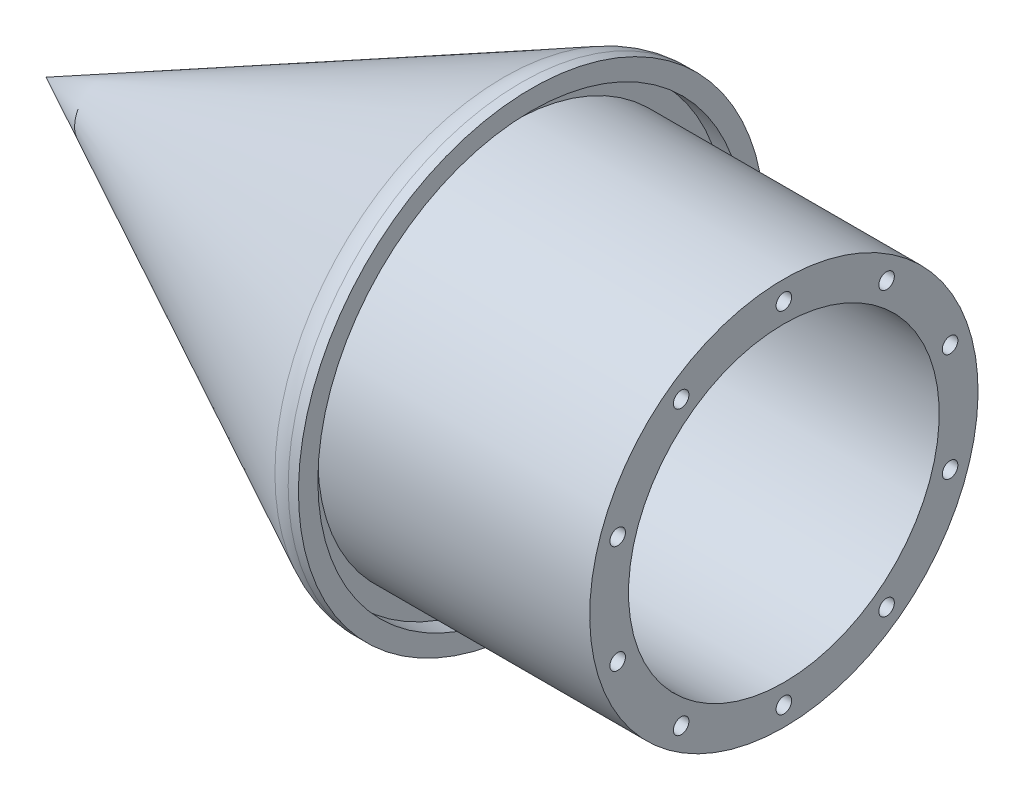
from build123d import *

# Parameters (mm, degrees)
SKETCH2_R          = 2
CUT_EXTRUDE1_DEPTH = 20
FILLET1_R          = 10


with BuildPart() as part:
    # Sketch1 → Revolve1 (revolve)
    with BuildSketch(Plane.XY, mode=Mode.PRIVATE) as revolve1_sk:
        Polygon((-170, 0), (-190, 0), (-70, 60), (-65, 60), (-65, 55), (-70, 55), (-70, 50), (0, 50), (0, 40), (-80, 40), (-80, 45), align=None)
    revolve(revolve1_sk.sketch.rotate(Axis((-170, 0, 0), (1, 0, 0)), 180), axis=Axis((-170, 0, 0), (1, 0, 0)))

    # Sketch2 → Cut-Extrude1 (cut)
    with BuildSketch(Plane(origin=(0, 0, 0), x_dir=(0, 0, -1), z_dir=(1, 0, 0))):
        with Locations(Location((0, 45, 0), (0, 0, 90))):
            Circle(SKETCH2_R)
        with Locations(Location((26.450336353, 36.405764747, 0), (0, 0, 90))):
            Circle(SKETCH2_R)
        with Locations(Location((42.797543233, 13.905764747, 0), (0, 0, 90))):
            Circle(SKETCH2_R)
        with Locations(Location((42.797543233, -13.905764747, 0), (0, 0, 90))):
            Circle(SKETCH2_R)
        with Locations(Location((26.450336353, -36.405764747, 0), (0, 0, 90))):
            Circle(SKETCH2_R)
        with Locations(Location((0, -45, 0), (0, 0, 90))):
            Circle(SKETCH2_R)
        with Locations(Location((-26.450336353, -36.405764747, 0), (0, 0, 90))):
            Circle(SKETCH2_R)
        with Locations(Location((-42.797543233, -13.905764747, 0), (0, 0, 90))):
            Circle(SKETCH2_R)
        with Locations(Location((-42.797543233, 13.905764747, 0), (0, 0, 90))):
            Circle(SKETCH2_R)
        with Locations(Location((-26.450336353, 36.405764747, 0), (0, 0, 90))):
            Circle(SKETCH2_R)
    extrude(amount=-CUT_EXTRUDE1_DEPTH, mode=Mode.SUBTRACT)

    # Fillet1
    fillet1_edges = [part.edges().sort_by_distance(p)[0] for p in [
        (-70, 60, 0),
    ]]
    fillet(fillet1_edges, radius=FILLET1_R)


solid = part.part
